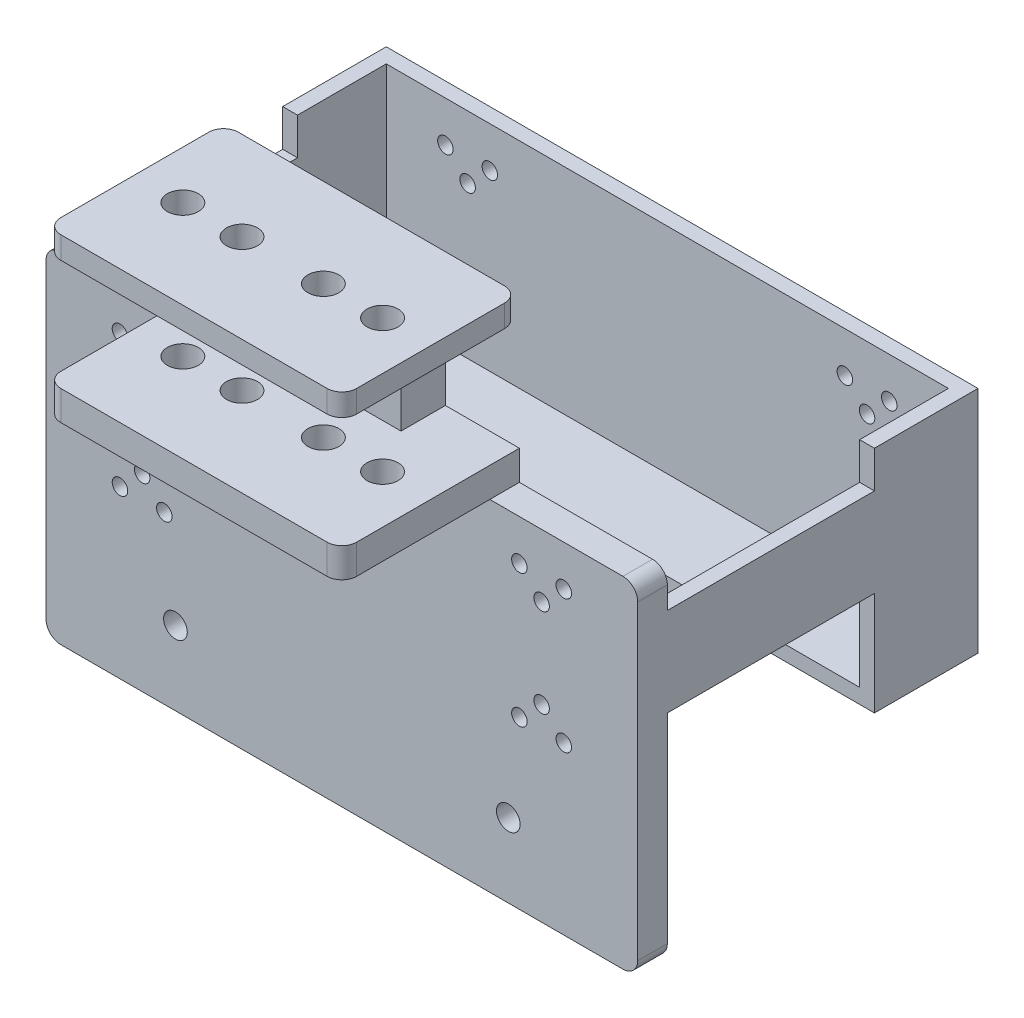
from build123d import *

# Parameters (mm, degrees)
SKETCH_1_W                      = 80
SKETCH_1_H                      = 29
EXTRUDE_1_DEPTH                 = 2
SKETCH_4_W                      = 2
SKETCH_4_H                      = 29
EXTRUDE_2_DEPTH                 = 12
SKETCH_6_W                      = 80
SKETCH_6_H                      = 14
EXTRUDE_4_DEPTH                 = 2
SKETCH_7_W                      = 2
SKETCH_7_H                      = 12
EXTRUDE_5_DEPTH                 = 28
SKETCH_8_W                      = 80
SKETCH_8_H                      = 31
EXTRUDE_6_DEPTH                 = 4
SKETCH_2_R                      = 1.05
CUT_EXTRUDE_1_DEPTH             = 62.711020086
CUT_EXTRUDE_1_DIRECTION_2_REACH = 63.711
SKETCH_12_W                     = 40
SKETCH_12_H                     = 24
EXTRUDE_9_DEPTH                 = 4
CUT_EXTRUDE_3_REACH             = 86.741
SKETCH_13_R                     = 2.1
CUT_EXTRUDE_3_DIRECTION_2_DEPTH = 85.74078121
SKETCH_14_W                     = 19.992460882
SKETCH_14_H                     = 6
EXTRUDE_10_DEPTH                = 15
SKETCH_15_W                     = 40
SKETCH_15_H                     = 24
EXTRUDE_11_DEPTH                = 3
SKETCH_16_R                     = 2.1
CUT_EXTRUDE_4_DEPTH             = 3
EXTRUDE_14_DEPTH                = 4
SKETCH_22_R                     = 1.6
CUT_EXTRUDE_5_DEPTH             = 4
FILLET_1_R                      = 2


with BuildPart() as part:
    # 草图1 → 凸台-拉伸1 (new body)
    with BuildSketch(Plane.XY):
        Rectangle(SKETCH_1_W, SKETCH_1_H)
    extrude(amount=EXTRUDE_1_DEPTH)

    # 草图4 → 凸台-拉伸2 (add)
    with BuildSketch(Plane.XY.offset(2)):
        with Locations((39, 0)):
            Rectangle(SKETCH_4_W, SKETCH_4_H)
        with Locations((-39, 0)):
            Rectangle(SKETCH_4_W, SKETCH_4_H)
    extrude(amount=EXTRUDE_2_DEPTH)

    # 草图6 → 凸台-拉伸4 (add)
    with BuildSketch(Plane.XZ.offset(14.5)):
        with Locations((0, 7)):
            Rectangle(SKETCH_6_W, SKETCH_6_H)
    extrude(amount=EXTRUDE_4_DEPTH)

    # 草图7 → 凸台-拉伸5 (add)
    with BuildSketch(Plane.XY.offset(14)):
        with Locations((-39, 3.5)):
            Rectangle(SKETCH_7_W, SKETCH_7_H)
        with Locations((39, 3.5)):
            Rectangle(SKETCH_7_W, SKETCH_7_H)
    extrude(amount=EXTRUDE_5_DEPTH)

    # 草图8 → 凸台-拉伸6 (add)
    with BuildSketch(Plane.XY.offset(42)):
        with Locations((0, -1)):
            Rectangle(SKETCH_8_W, SKETCH_8_H)
    extrude(amount=EXTRUDE_6_DEPTH)

    # 草图2 → 切除-拉伸1 (cut)
    with BuildSketch(Plane.XY.offset(2)):
        with Locations((-30, 9)):
            Circle(SKETCH_2_R)
        with Locations((-24, 9)):
            Circle(SKETCH_2_R)
        with Locations((-27, 6)):
            Circle(SKETCH_2_R)
        with Locations((-27, -6)):
            Circle(SKETCH_2_R)
        with Locations((-24, -9)):
            Circle(SKETCH_2_R)
        with Locations((-30, -9)):
            Circle(SKETCH_2_R)
        with Locations((27, -6)):
            Circle(SKETCH_2_R)
        with Locations((30, -9)):
            Circle(SKETCH_2_R)
        with Locations((24, -9)):
            Circle(SKETCH_2_R)
        with Locations((27, 6)):
            Circle(SKETCH_2_R)
        with Locations((30, 9)):
            Circle(SKETCH_2_R)
        with Locations((24, 9)):
            Circle(SKETCH_2_R)
    extrude(amount=-CUT_EXTRUDE_1_DEPTH, mode=Mode.SUBTRACT)

    # 切除-拉伸1 direction 2: up to this face of the body (flat: up to its plane)
    cut_extrude_1_direction_2_end = Plane(part.part.faces().sort_by_distance((0, -1, 46))[0])
    # 草图2 → 切除-拉伸1 direction 2 (cut, up to the picked face)
    with BuildSketch(Plane.XY.offset(2), mode=Mode.PRIVATE) as cut_extrude_1_direction_2_sk1:
        with Locations((-30, 9)):
            Circle(SKETCH_2_R)
    cut_extrude_1_direction_2_tool1 = split(extrude(cut_extrude_1_direction_2_sk1.sketch, amount=CUT_EXTRUDE_1_DIRECTION_2_REACH, mode=Mode.PRIVATE), bisect_by=cut_extrude_1_direction_2_end, keep=Keep.BOTH, mode=Mode.PRIVATE)
    # 草图2 → 切除-拉伸1 direction 2 (cut, up to the picked face)
    with BuildSketch(Plane.XY.offset(2), mode=Mode.PRIVATE) as cut_extrude_1_direction_2_sk2:
        with Locations((-24, 9)):
            Circle(SKETCH_2_R)
    cut_extrude_1_direction_2_tool2 = split(extrude(cut_extrude_1_direction_2_sk2.sketch, amount=CUT_EXTRUDE_1_DIRECTION_2_REACH, mode=Mode.PRIVATE), bisect_by=cut_extrude_1_direction_2_end, keep=Keep.BOTH, mode=Mode.PRIVATE)
    # 草图2 → 切除-拉伸1 direction 2 (cut, up to the picked face)
    with BuildSketch(Plane.XY.offset(2), mode=Mode.PRIVATE) as cut_extrude_1_direction_2_sk3:
        with Locations((-27, 6)):
            Circle(SKETCH_2_R)
    cut_extrude_1_direction_2_tool3 = split(extrude(cut_extrude_1_direction_2_sk3.sketch, amount=CUT_EXTRUDE_1_DIRECTION_2_REACH, mode=Mode.PRIVATE), bisect_by=cut_extrude_1_direction_2_end, keep=Keep.BOTH, mode=Mode.PRIVATE)
    # 草图2 → 切除-拉伸1 direction 2 (cut, up to the picked face)
    with BuildSketch(Plane.XY.offset(2), mode=Mode.PRIVATE) as cut_extrude_1_direction_2_sk4:
        with Locations((-27, -6)):
            Circle(SKETCH_2_R)
    cut_extrude_1_direction_2_tool4 = split(extrude(cut_extrude_1_direction_2_sk4.sketch, amount=CUT_EXTRUDE_1_DIRECTION_2_REACH, mode=Mode.PRIVATE), bisect_by=cut_extrude_1_direction_2_end, keep=Keep.BOTH, mode=Mode.PRIVATE)
    # 草图2 → 切除-拉伸1 direction 2 (cut, up to the picked face)
    with BuildSketch(Plane.XY.offset(2), mode=Mode.PRIVATE) as cut_extrude_1_direction_2_sk5:
        with Locations((-24, -9)):
            Circle(SKETCH_2_R)
    cut_extrude_1_direction_2_tool5 = split(extrude(cut_extrude_1_direction_2_sk5.sketch, amount=CUT_EXTRUDE_1_DIRECTION_2_REACH, mode=Mode.PRIVATE), bisect_by=cut_extrude_1_direction_2_end, keep=Keep.BOTH, mode=Mode.PRIVATE)
    # 草图2 → 切除-拉伸1 direction 2 (cut, up to the picked face)
    with BuildSketch(Plane.XY.offset(2), mode=Mode.PRIVATE) as cut_extrude_1_direction_2_sk6:
        with Locations((-30, -9)):
            Circle(SKETCH_2_R)
    cut_extrude_1_direction_2_tool6 = split(extrude(cut_extrude_1_direction_2_sk6.sketch, amount=CUT_EXTRUDE_1_DIRECTION_2_REACH, mode=Mode.PRIVATE), bisect_by=cut_extrude_1_direction_2_end, keep=Keep.BOTH, mode=Mode.PRIVATE)
    # 草图2 → 切除-拉伸1 direction 2 (cut, up to the picked face)
    with BuildSketch(Plane.XY.offset(2), mode=Mode.PRIVATE) as cut_extrude_1_direction_2_sk7:
        with Locations((27, -6)):
            Circle(SKETCH_2_R)
    cut_extrude_1_direction_2_tool7 = split(extrude(cut_extrude_1_direction_2_sk7.sketch, amount=CUT_EXTRUDE_1_DIRECTION_2_REACH, mode=Mode.PRIVATE), bisect_by=cut_extrude_1_direction_2_end, keep=Keep.BOTH, mode=Mode.PRIVATE)
    # 草图2 → 切除-拉伸1 direction 2 (cut, up to the picked face)
    with BuildSketch(Plane.XY.offset(2), mode=Mode.PRIVATE) as cut_extrude_1_direction_2_sk8:
        with Locations((30, -9)):
            Circle(SKETCH_2_R)
    cut_extrude_1_direction_2_tool8 = split(extrude(cut_extrude_1_direction_2_sk8.sketch, amount=CUT_EXTRUDE_1_DIRECTION_2_REACH, mode=Mode.PRIVATE), bisect_by=cut_extrude_1_direction_2_end, keep=Keep.BOTH, mode=Mode.PRIVATE)
    # 草图2 → 切除-拉伸1 direction 2 (cut, up to the picked face)
    with BuildSketch(Plane.XY.offset(2), mode=Mode.PRIVATE) as cut_extrude_1_direction_2_sk9:
        with Locations((24, -9)):
            Circle(SKETCH_2_R)
    cut_extrude_1_direction_2_tool9 = split(extrude(cut_extrude_1_direction_2_sk9.sketch, amount=CUT_EXTRUDE_1_DIRECTION_2_REACH, mode=Mode.PRIVATE), bisect_by=cut_extrude_1_direction_2_end, keep=Keep.BOTH, mode=Mode.PRIVATE)
    # 草图2 → 切除-拉伸1 direction 2 (cut, up to the picked face)
    with BuildSketch(Plane.XY.offset(2), mode=Mode.PRIVATE) as cut_extrude_1_direction_2_sk10:
        with Locations((27, 6)):
            Circle(SKETCH_2_R)
    cut_extrude_1_direction_2_tool10 = split(extrude(cut_extrude_1_direction_2_sk10.sketch, amount=CUT_EXTRUDE_1_DIRECTION_2_REACH, mode=Mode.PRIVATE), bisect_by=cut_extrude_1_direction_2_end, keep=Keep.BOTH, mode=Mode.PRIVATE)
    # 草图2 → 切除-拉伸1 direction 2 (cut, up to the picked face)
    with BuildSketch(Plane.XY.offset(2), mode=Mode.PRIVATE) as cut_extrude_1_direction_2_sk11:
        with Locations((30, 9)):
            Circle(SKETCH_2_R)
    cut_extrude_1_direction_2_tool11 = split(extrude(cut_extrude_1_direction_2_sk11.sketch, amount=CUT_EXTRUDE_1_DIRECTION_2_REACH, mode=Mode.PRIVATE), bisect_by=cut_extrude_1_direction_2_end, keep=Keep.BOTH, mode=Mode.PRIVATE)
    # 草图2 → 切除-拉伸1 direction 2 (cut, up to the picked face)
    with BuildSketch(Plane.XY.offset(2), mode=Mode.PRIVATE) as cut_extrude_1_direction_2_sk12:
        with Locations((24, 9)):
            Circle(SKETCH_2_R)
    cut_extrude_1_direction_2_tool12 = split(extrude(cut_extrude_1_direction_2_sk12.sketch, amount=CUT_EXTRUDE_1_DIRECTION_2_REACH, mode=Mode.PRIVATE), bisect_by=cut_extrude_1_direction_2_end, keep=Keep.BOTH, mode=Mode.PRIVATE)
    add(cut_extrude_1_direction_2_tool1.solids().sort_by(Axis((-30, 9, 2), (0, 0, 1)))[0], mode=Mode.SUBTRACT)
    add(cut_extrude_1_direction_2_tool2.solids().sort_by(Axis((-24, 9, 2), (0, 0, 1)))[0], mode=Mode.SUBTRACT)
    add(cut_extrude_1_direction_2_tool3.solids().sort_by(Axis((-27, 6, 2), (0, 0, 1)))[0], mode=Mode.SUBTRACT)
    add(cut_extrude_1_direction_2_tool4.solids().sort_by(Axis((-27, -6, 2), (0, 0, 1)))[0], mode=Mode.SUBTRACT)
    add(cut_extrude_1_direction_2_tool5.solids().sort_by(Axis((-24, -9, 2), (0, 0, 1)))[0], mode=Mode.SUBTRACT)
    add(cut_extrude_1_direction_2_tool6.solids().sort_by(Axis((-30, -9, 2), (0, 0, 1)))[0], mode=Mode.SUBTRACT)
    add(cut_extrude_1_direction_2_tool7.solids().sort_by(Axis((27, -6, 2), (0, 0, 1)))[0], mode=Mode.SUBTRACT)
    add(cut_extrude_1_direction_2_tool8.solids().sort_by(Axis((30, -9, 2), (0, 0, 1)))[0], mode=Mode.SUBTRACT)
    add(cut_extrude_1_direction_2_tool9.solids().sort_by(Axis((24, -9, 2), (0, 0, 1)))[0], mode=Mode.SUBTRACT)
    add(cut_extrude_1_direction_2_tool10.solids().sort_by(Axis((27, 6, 2), (0, 0, 1)))[0], mode=Mode.SUBTRACT)
    add(cut_extrude_1_direction_2_tool11.solids().sort_by(Axis((30, 9, 2), (0, 0, 1)))[0], mode=Mode.SUBTRACT)
    add(cut_extrude_1_direction_2_tool12.solids().sort_by(Axis((24, 9, 2), (0, 0, 1)))[0], mode=Mode.SUBTRACT)

    # 草图12 → 凸台-拉伸9 (add)
    with BuildSketch(Plane(origin=(0, 14.5, 0), x_dir=(1, 0, 0), z_dir=(0, 1, 0))):
        with Locations((0, -54)):
            Rectangle(SKETCH_12_W, SKETCH_12_H)
    extrude(amount=EXTRUDE_9_DEPTH)

    # 草图13 → 切除-拉伸3 (cut, up to next)
    with BuildSketch(Plane(origin=(0, 18.5, 0), x_dir=(1, 0, 0), z_dir=(0, 1, 0)), mode=Mode.PRIVATE) as cut_extrude_3_sk1:
        with Locations(Location((-13.5, -54, 0), (0, 0, 90))):
            Circle(SKETCH_13_R)
    cut_extrude_3_tool1 = extrude(cut_extrude_3_sk1.sketch, amount=-CUT_EXTRUDE_3_REACH, mode=Mode.PRIVATE) & part.part
    # 草图13 → 切除-拉伸3 (cut, up to next)
    with BuildSketch(Plane(origin=(0, 18.5, 0), x_dir=(1, 0, 0), z_dir=(0, 1, 0)), mode=Mode.PRIVATE) as cut_extrude_3_sk2:
        with Locations(Location((-5.5, -54, 0), (0, 0, 90))):
            Circle(SKETCH_13_R)
    cut_extrude_3_tool2 = extrude(cut_extrude_3_sk2.sketch, amount=-CUT_EXTRUDE_3_REACH, mode=Mode.PRIVATE) & part.part
    # 草图13 → 切除-拉伸3 (cut, up to next)
    with BuildSketch(Plane(origin=(0, 18.5, 0), x_dir=(1, 0, 0), z_dir=(0, 1, 0)), mode=Mode.PRIVATE) as cut_extrude_3_sk3:
        with Locations(Location((5.5, -54, 0), (0, 0, 90))):
            Circle(SKETCH_13_R)
    cut_extrude_3_tool3 = extrude(cut_extrude_3_sk3.sketch, amount=-CUT_EXTRUDE_3_REACH, mode=Mode.PRIVATE) & part.part
    # 草图13 → 切除-拉伸3 (cut, up to next)
    with BuildSketch(Plane(origin=(0, 18.5, 0), x_dir=(1, 0, 0), z_dir=(0, 1, 0)), mode=Mode.PRIVATE) as cut_extrude_3_sk4:
        with Locations(Location((13.5, -54, 0), (0, 0, 90))):
            Circle(SKETCH_13_R)
    cut_extrude_3_tool4 = extrude(cut_extrude_3_sk4.sketch, amount=-CUT_EXTRUDE_3_REACH, mode=Mode.PRIVATE) & part.part
    add(cut_extrude_3_tool1.solids().sort_by_distance((-13.5, 18.5, 54))[0], mode=Mode.SUBTRACT)
    add(cut_extrude_3_tool2.solids().sort_by_distance((-5.5, 18.5, 54))[0], mode=Mode.SUBTRACT)
    add(cut_extrude_3_tool3.solids().sort_by_distance((5.5, 18.5, 54))[0], mode=Mode.SUBTRACT)
    add(cut_extrude_3_tool4.solids().sort_by_distance((13.5, 18.5, 54))[0], mode=Mode.SUBTRACT)

    # 草图13 → 切除-拉伸3 direction 2 (cut)
    with BuildSketch(Plane(origin=(0, 18.5, 0), x_dir=(1, 0, 0), z_dir=(0, 1, 0))):
        with Locations(Location((-13.5, -54, 0), (0, 0, 90))):
            Circle(SKETCH_13_R)
        with Locations(Location((-5.5, -54, 0), (0, 0, 90))):
            Circle(SKETCH_13_R)
        with Locations(Location((5.5, -54, 0), (0, 0, 90))):
            Circle(SKETCH_13_R)
        with Locations(Location((13.5, -54, 0), (0, 0, 90))):
            Circle(SKETCH_13_R)
    extrude(amount=CUT_EXTRUDE_3_DIRECTION_2_DEPTH, mode=Mode.SUBTRACT)

    # 草图14 → 凸台-拉伸10 (add)
    with BuildSketch(Plane(origin=(0, 18.5, 0), x_dir=(1, 0, 0), z_dir=(0, 1, 0))):
        with Locations((0, -45)):
            Rectangle(SKETCH_14_W, SKETCH_14_H)
    extrude(amount=EXTRUDE_10_DEPTH)

    # 草图15 → 凸台-拉伸11 (add)
    with BuildSketch(Plane(origin=(0, 33.5, 0), x_dir=(1, 0, 0), z_dir=(0, 1, 0))):
        with Locations((0, -54)):
            Rectangle(SKETCH_15_W, SKETCH_15_H)
    extrude(amount=EXTRUDE_11_DEPTH)

    # 草图16 → 切除-拉伸4 (cut)
    with BuildSketch(Plane(origin=(0, 36.5, 0), x_dir=(1, 0, 0), z_dir=(0, 1, 0))):
        with Locations(Location((-13.5, -54, 0), (0, 0, 90))):
            Circle(SKETCH_16_R)
        with Locations(Location((-5.5, -54, 0), (0, 0, 90))):
            Circle(SKETCH_16_R)
        with Locations(Location((5.5, -54, 0), (0, 0, 90))):
            Circle(SKETCH_16_R)
        with Locations(Location((13.5, -54, 0), (0, 0, 90))):
            Circle(SKETCH_16_R)
    extrude(amount=-CUT_EXTRUDE_4_DEPTH, mode=Mode.SUBTRACT)

    # 草图21 → 凸台-拉伸14 (add)
    with BuildSketch(Plane.XY.offset(46)):
        Polygon((0, -16.5), (40, -16.5), (40, -31.5), (-40, -31.5), (-40, -16.5), align=None)
    extrude(amount=-EXTRUDE_14_DEPTH)

    # 草图22 → 切除-拉伸5 (cut)
    with BuildSketch(Plane.XY.offset(46)):
        with Locations((-22.5, -21.5)):
            Circle(SKETCH_22_R)
        with Locations((22.5, -21.5)):
            Circle(SKETCH_22_R)
    extrude(amount=-CUT_EXTRUDE_5_DEPTH, mode=Mode.SUBTRACT)

    # 圆角1
    fillet_1_edges = [part.edges().sort_by_distance(p)[0] for p in [
        (-20, 16.5, 66),
        (20, 16.5, 66),
        (-20, 35, 42),
        (-20, 35, 66),
        (20, 35, 66),
        (20, 35, 42),
        (40, -31.5, 44),
        (-40, -31.5, 44),
        (-40, 14.5, 44),
        (40, 14.5, 44),
    ]]
    fillet(fillet_1_edges, radius=FILLET_1_R)


solid = part.part
